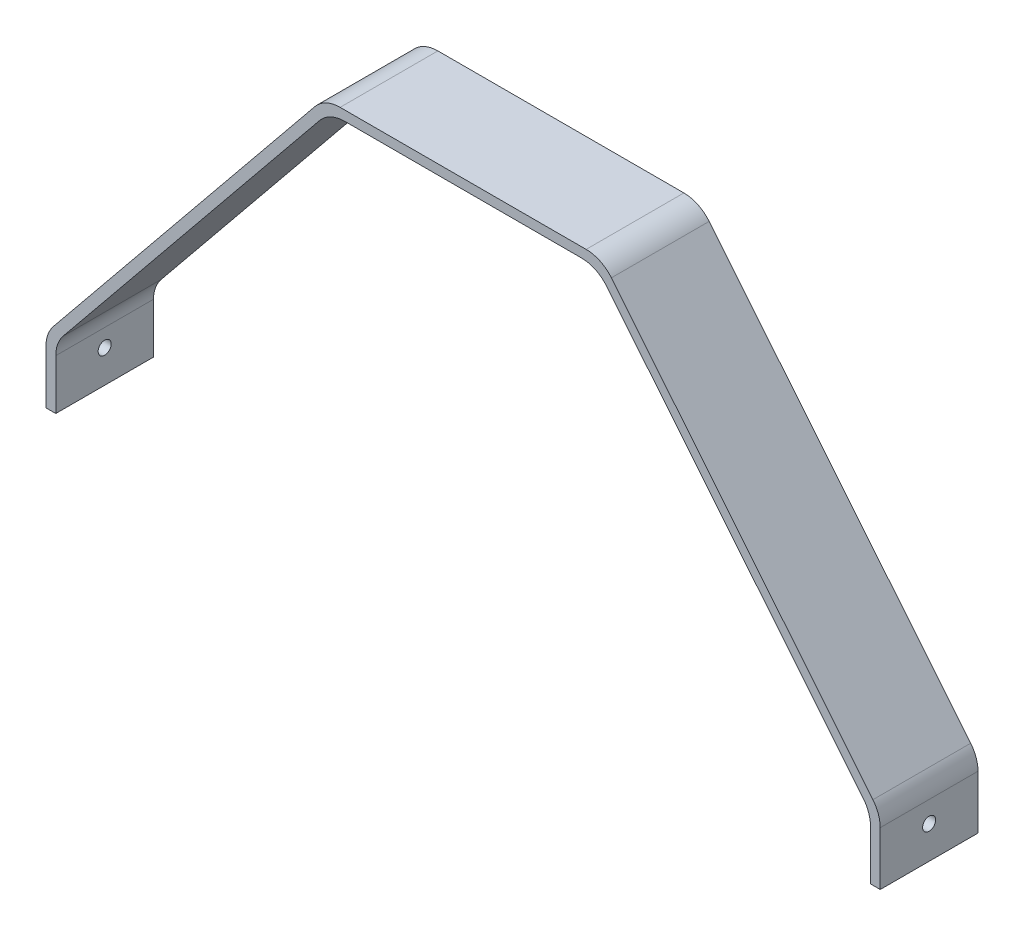
from build123d import *

# Parameters (mm, degrees)
BOSS_EXTRUDE1_DEPTH     = 30
FILLET1_R               = 10
CUT_EXTRUDE1_DEPTH      = 287.462912085
CUT_EXTRUDE1_DEPTH_BACK = 287.462912085
SKETCH2_R               = 2


with BuildPart() as part:
    # Sketch1 → Boss-Extrude1 (new body)
    with BuildSketch(Plane.XY):
        Polygon((128, -125), (125, -125), (125, -106.066937462), (41.07406521, -3), (-41.07406521, -3), (-125, -106.066937462), (-125, -125), (-128, -125), (-128, -105), (-42.5, 0), (42.5, 0), (128, -105), align=None)
    extrude(amount=BOSS_EXTRUDE1_DEPTH)

    # Fillet1
    fillet1_edges = [part.edges().sort_by_distance(p)[0] for p in [
        (125, -106.066937462, 15),
        (41.07406521, -3, 15),
        (-41.07406521, -3, 15),
        (-125, -106.066937462, 15),
        (-128, -105, 15),
        (-42.5, 0, 15),
        (42.5, 0, 15),
        (128, -105, 15),
    ]]
    fillet(fillet1_edges, radius=FILLET1_R)

    # Sketch2 → Cut-Extrude1 (cut, two sides: drawn at the far end of the back side and taken through both)
    with BuildSketch(Plane(origin=(128, 0, 0), x_dir=(0, 0, -1), z_dir=(1, 0, 0)).offset(-CUT_EXTRUDE1_DEPTH_BACK)):
        with Locations((-15, -115)):
            Circle(SKETCH2_R)
    extrude(amount=CUT_EXTRUDE1_DEPTH + CUT_EXTRUDE1_DEPTH_BACK, mode=Mode.SUBTRACT)


solid = part.part
